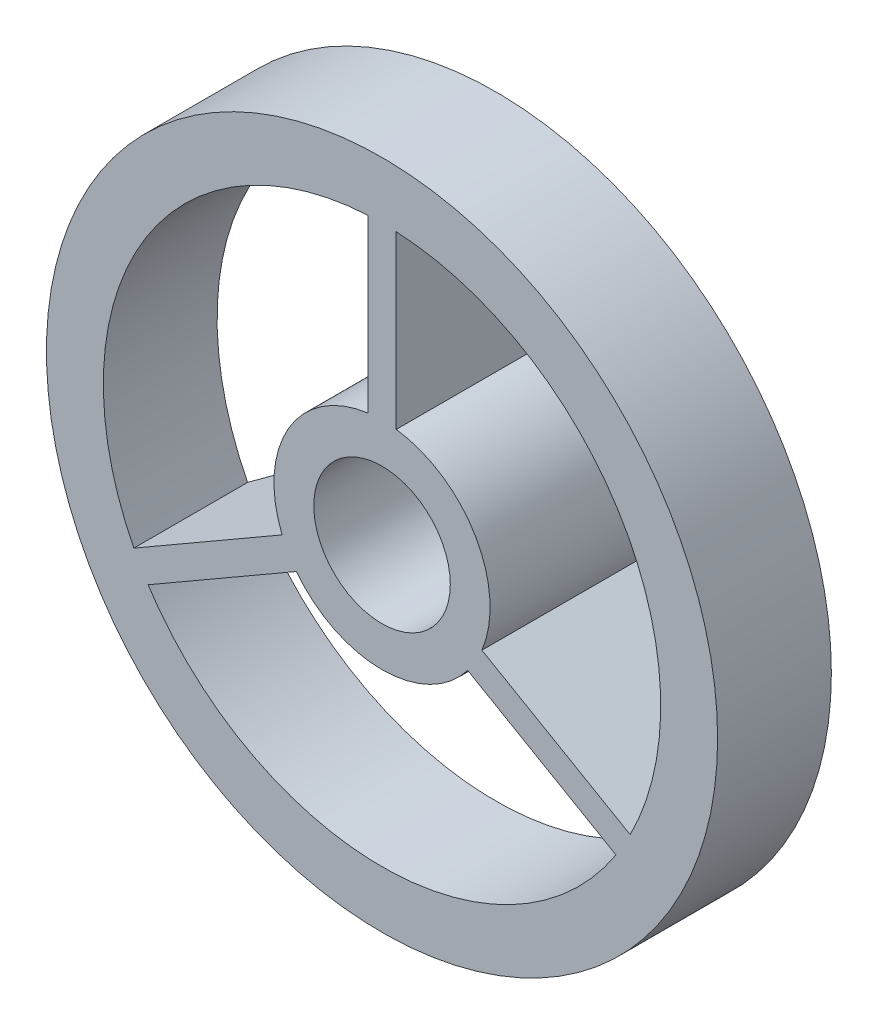
from build123d import *

# Parameters (mm, degrees)
SKETCH3_R           = 1.9
SKETCH3_R_2         = 1.2
BOSS_EXTRUDE4_DEPTH = 3.5
SKETCH3_3_R         = 5.9
SKETCH3_3_R_2       = 4.9
BOSS_EXTRUDE5_DEPTH = 2
BOSS_EXTRUDE6_DEPTH = 0.25
CIRPATTERN1_COUNT   = 3


with BuildPart() as part:
    # Sketch3 → Boss-Extrude4 (new body)
    with BuildSketch(Plane.XY):
        Circle(SKETCH3_R)
        Circle(SKETCH3_R_2, mode=Mode.SUBTRACT)
    extrude(amount=-BOSS_EXTRUDE4_DEPTH)



with BuildPart() as body_2:
    # Sketch3<3> → Boss-Extrude5 (new body)
    with BuildSketch(Plane.XY):
        Circle(SKETCH3_3_R)
        Circle(SKETCH3_3_R_2, mode=Mode.SUBTRACT)
    extrude(amount=-BOSS_EXTRUDE5_DEPTH)


with BuildPart() as part_1:
    add(part.part)

    add(body_2.part)  # Boss-Extrude6 merges body 2
    # Sketch5 → Boss-Extrude6 (add, symmetric)
    with BuildSketch(Plane(origin=(0, 0, 0), x_dir=(0, 0, -1), z_dir=(1, 0, 0))):
        Polygon((0, 4.9), (0, 1.903401583), (0, 1.703401583), (3.5, 1.703401583), (3.5, 1.903401583), (2, 4.9), align=None)
    boss_extrude6 = extrude(amount=BOSS_EXTRUDE6_DEPTH, both=True)

    # CirPattern1: Boss-Extrude6 ×3 about axis
    cirpattern1_axis = Axis((0, 0, 0), (0, 0, 1))
    for i in range(1, CIRPATTERN1_COUNT):
        add(boss_extrude6.rotate(cirpattern1_axis, i * 360 / CIRPATTERN1_COUNT))


solid = part_1.part
